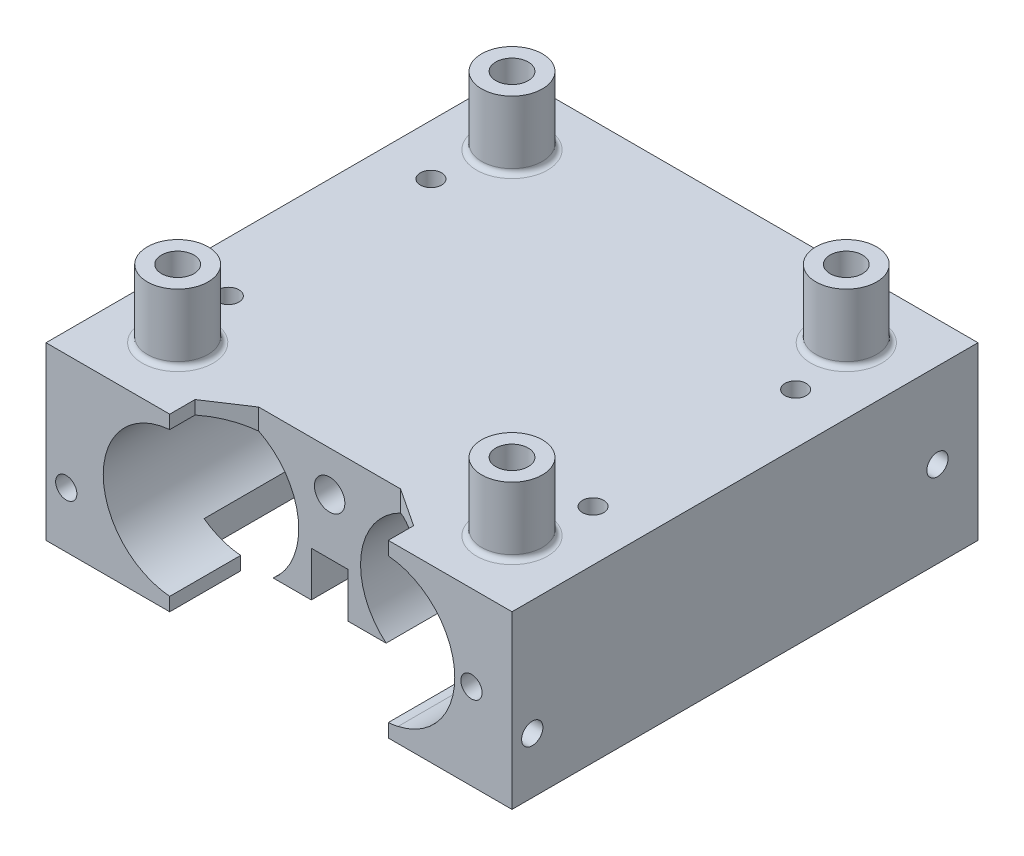
from build123d import *

# Parameters (mm, degrees)
CROQUIS4_W              = 46
CROQUIS4_H              = 46
SALIENTE_EXTRUIR1_DEPTH = 16.9
TALADRO1_D              = 2.1
TALADRO1_DEPTH          = 3
TALADRO1_TIP            = 0.63090365
TALADRO6_D              = 2.1
TALADRO6_DEPTH          = 3
TALADRO6_TIP            = 0.63090365
TALADRO7_D              = 2.1
TALADRO7_DEPTH          = 3
TALADRO7_TIP            = 0.63090365
TALADRO8_D              = 2.1
TALADRO8_DEPTH          = 3
TALADRO8_TIP            = 0.63090365
TALADRO10_D             = 2.1
TALADRO10_DEPTH         = 3
TALADRO10_TIP           = 0.63090365
TALADRO11_D             = 2.1
TALADRO11_DEPTH         = 3
TALADRO11_TIP           = 0.63090365
CROQUIS36_R             = 3
SALIENTE_EXTRUIR3_DEPTH = 6.7
TALADRO12_D             = 3.2
TALADRO12_DEPTH         = 7.6
TALADRO12_TIP           = 0.96137699
REDONDEO1_R             = 0.5
CROQUIS32_R             = 7.15
CORTAR_EXTRUIR1_DEPTH   = 46
CROQUIS42_W             = 23.493404382
CROQUIS42_H             = 32
CORTAR_EXTRUIR5_DEPTH   = 3
CORTAR_EXTRUIR3_DEPTH   = 37.655286113
CROQUIS43_W             = 2.65
CROQUIS43_H             = 3.393615988
CORTAR_EXTRUIR6_DEPTH   = 32
CORTAR_EXTRUIR7_DEPTH   = 4
CORTAR_EXTRUIR8_REACH   = 55.385
CROQUIS45_W             = 1.95106162
CROQUIS45_H             = 3
CORTAR_EXTRUIR9_DEPTH   = 31
CORTAR_EXTRUIR10_START  = -2
CORTAR_EXTRUIR10_DEPTH  = 2
CROQUIS49_W             = 3.787113981
CROQUIS49_H             = 2.270030689
CORTAR_EXTRUIR11_DEPTH  = 23
CROQUIS53_R             = 1.5
CORTAR_EXTRUIR13_DEPTH  = 53.601901106


with BuildPart() as part:
    # Croquis4 → Saliente-Extruir1 (new body)
    with BuildSketch(Plane(origin=(0, 0, 0), x_dir=(1, 0, 0), z_dir=(0, 1, 0))):
        Rectangle(CROQUIS4_W, CROQUIS4_H)
    extrude(amount=SALIENTE_EXTRUIR1_DEPTH)

    # Taladro1
    with Locations(Plane.XY.offset(23)):
        with Locations((-21, 5.5), (19, 8.5)):
            Hole(TALADRO1_D / 2, depth=TALADRO1_DEPTH)
            with Locations((0, 0, -(TALADRO1_DEPTH + TALADRO1_TIP / 2))):  # 118° drill point
                Cone(0, TALADRO1_D / 2, TALADRO1_TIP, mode=Mode.SUBTRACT)

    # Taladro6
    with Locations(Plane(origin=(23, 0, 0), x_dir=(0, 0, -1), z_dir=(1, 0, 0))):
        with Locations((-21, 5.5), (19, 8.5)):
            Hole(TALADRO6_D / 2, depth=TALADRO6_DEPTH)
            with Locations((0, 0, -(TALADRO6_DEPTH + TALADRO6_TIP / 2))):  # 118° drill point
                Cone(0, TALADRO6_D / 2, TALADRO6_TIP, mode=Mode.SUBTRACT)

    # Taladro7
    with Locations(Plane(origin=(0, 0, -23), x_dir=(-1, 0, 0), z_dir=(0, 0, -1))):
        with Locations((-21, 5.5), (19, 8.5)):
            Hole(TALADRO7_D / 2, depth=TALADRO7_DEPTH)
            with Locations((0, 0, -(TALADRO7_DEPTH + TALADRO7_TIP / 2))):  # 118° drill point
                Cone(0, TALADRO7_D / 2, TALADRO7_TIP, mode=Mode.SUBTRACT)

    # Taladro8
    with Locations(Plane.ZY.offset(23)):
        with Locations((-21, 5.5), (19, 8.5)):
            Hole(TALADRO8_D / 2, depth=TALADRO8_DEPTH)
            with Locations((0, 0, -(TALADRO8_DEPTH + TALADRO8_TIP / 2))):  # 118° drill point
                Cone(0, TALADRO8_D / 2, TALADRO8_TIP, mode=Mode.SUBTRACT)

    # Taladro10
    with Locations(Plane(origin=(-21, 0, 7), x_dir=(0, 0, -1), z_dir=(0, -1, 0))):
        with Locations((0, 0), (0, 42), (14, 42), (14, 0)):
            Hole(TALADRO10_D / 2, depth=TALADRO10_DEPTH)
            with Locations((0, 0, -(TALADRO10_DEPTH + TALADRO10_TIP / 2))):  # 118° drill point
                Cone(0, TALADRO10_D / 2, TALADRO10_TIP, mode=Mode.SUBTRACT)

    # Taladro11
    with Locations(Plane(origin=(-18, 16.9, -10), x_dir=(0, 0, 1), z_dir=(0, 1, 0))):
        with Locations((0, 0), (0, 36), (20, 36), (20, 0)):
            Hole(TALADRO11_D / 2, depth=TALADRO11_DEPTH)
            with Locations((0, 0, -(TALADRO11_DEPTH + TALADRO11_TIP / 2))):  # 118° drill point
                Cone(0, TALADRO11_D / 2, TALADRO11_TIP, mode=Mode.SUBTRACT)

    # Croquis36 → Saliente-Extruir3 (add)
    with BuildSketch(Plane(origin=(0, 16.9, 0), x_dir=(1, 0, 0), z_dir=(0, 1, 0))):
        with Locations(Location((-16.5, 16.5, 0), (0, 0, 90))):
            Circle(CROQUIS36_R)
        with Locations(Location((16.5, 16.5, 0), (0, 0, 90))):
            Circle(CROQUIS36_R)
        with Locations(Location((16.5, -16.5, 0), (0, 0, 90))):
            Circle(CROQUIS36_R)
        with Locations(Location((-16.5, -16.5, 0), (0, 0, 90))):
            Circle(CROQUIS36_R)
    extrude(amount=SALIENTE_EXTRUIR3_DEPTH)

    # Taladro12
    with Locations(Plane(origin=(-16.5, 23.6, 16.5), x_dir=(0, 0, 1), z_dir=(0, 1, 0))):
        with Locations((0, 0), (0, 33), (-33, 33), (-33, 0)):
            Hole(TALADRO12_D / 2, depth=TALADRO12_DEPTH)
            with Locations((0, 0, -(TALADRO12_DEPTH + TALADRO12_TIP / 2))):  # 118° drill point
                Cone(0, TALADRO12_D / 2, TALADRO12_TIP, mode=Mode.SUBTRACT)

    # Redondeo1
    redondeo1_edges = [part.edges().sort_by_distance(p)[0] for p in [
        (-16.5, 16.9, 19.5),
        (-16.5, 16.9, -13.5),
        (16.5, 16.9, -13.5),
        (16.5, 16.9, 19.5),
    ]]
    fillet(redondeo1_edges, radius=REDONDEO1_R)

    # Croquis32 → Cortar-Extruir1 (cut)
    with BuildSketch(Plane.XY.offset(23)):
        with Locations((-10.2, 8.45)):
            Circle(CROQUIS32_R)
        with Locations(Location((10.2, 8.45, 0), (0, 0, 180))):
            Circle(CROQUIS32_R)
    extrude(amount=-CORTAR_EXTRUIR1_DEPTH, mode=Mode.SUBTRACT)

    # Croquis42 → Cortar-Extruir5 (cut)
    with BuildSketch(Plane.XZ):
        Rectangle(CROQUIS42_W, CROQUIS42_H)
    extrude(amount=-CORTAR_EXTRUIR5_DEPTH, mode=Mode.SUBTRACT)

    # Croquis39 → Cortar-Extruir3 (cut, through all)
    with BuildSketch(Plane(origin=(0, 16.9, 0), x_dir=(1, 0, 0), z_dir=(0, 1, 0))):
        Polygon((-10.787113981, -20.5), (-10.787113981, -23), (10.787113981, -23), (10.787113981, -20.5), (7, -18), (-7, -18), align=None)
    extrude(amount=-CORTAR_EXTRUIR3_DEPTH, mode=Mode.SUBTRACT)

    # Croquis43 → Cortar-Extruir6 (cut)
    with BuildSketch(Plane.XY.offset(-16)):
        with Locations((-13.071702191, 1.696807994)):
            Rectangle(CROQUIS43_W, CROQUIS43_H)
    extrude(amount=CORTAR_EXTRUIR6_DEPTH, mode=Mode.SUBTRACT)

    # Croquis44 → Cortar-Extruir7 (cut)
    with BuildSketch(Plane(origin=(0, 0, -23), x_dir=(-1, 0, 0), z_dir=(0, 0, -1))):
        Polygon((-3.977126612, 9.408717688), (-3.977126612, 7.491282312), (-0.97553081, 7.491282312), (-0.97553081, 0), (0.97553081, 0), (0.97553081, 7.491282312), (3.977126612, 7.491282312), (3.977126612, 9.408717688), (4.878692477, 9.408717688), (4.878692477, 12.483889819), (2.725, 12.483889819), (-2.725, 12.483889819), (-4.878692477, 12.483889819), (-4.878692477, 9.408717688), align=None)
    extrude(amount=-CORTAR_EXTRUIR7_DEPTH, mode=Mode.SUBTRACT)

    # Croquis45 → Cortar-Extruir8 (cut, up to next)
    with BuildSketch(Plane(origin=(0, 0, -19), x_dir=(-1, 0, 0), z_dir=(0, 0, -1)), mode=Mode.PRIVATE) as cortar_extruir8_sk1:
        with Locations((0, 1.5)):
            Rectangle(CROQUIS45_W, CROQUIS45_H)
    cortar_extruir8_tool1 = extrude(cortar_extruir8_sk1.sketch, amount=-CORTAR_EXTRUIR8_REACH, mode=Mode.PRIVATE) & part.part
    add(cortar_extruir8_tool1.solids().sort_by_distance((0, 1.5, -19))[0], mode=Mode.SUBTRACT)

    # Croquis46 → Cortar-Extruir9 (cut)
    with BuildSketch(Plane.XY.offset(18)):
        Polygon((0, 0), (-1.814283194, 0), (-3.131306321, 0), (-1.814283194, 2.498681243), (-1.814283194, 7.427741726), (0, 7.427741726), (1.814283194, 7.427741726), (1.814283194, 2.498681243), (3.131306321, 0), (1.814283194, 0), align=None)
    extrude(amount=-CORTAR_EXTRUIR9_DEPTH, mode=Mode.SUBTRACT)

    # Croquis47 → Cortar-Extruir10 (cut)
    with BuildSketch(Plane.XY.offset(18).offset(CORTAR_EXTRUIR10_START)):
        Polygon((-7, 0), (-7, 3), (7.00622096, 3), (7, 0), align=None)
    extrude(amount=CORTAR_EXTRUIR10_DEPTH, mode=Mode.SUBTRACT)

    # Croquis49 → Cortar-Extruir11 (cut)
    with BuildSketch(Plane.XY):
        with Locations((8.893556991, 1.135015344)):
            Rectangle(CROQUIS49_W, CROQUIS49_H)
        with Locations((-8.893556991, 1.135015344)):
            Rectangle(CROQUIS49_W, CROQUIS49_H)
    extrude(amount=CORTAR_EXTRUIR11_DEPTH, mode=Mode.SUBTRACT)

    # Croquis53 → Cortar-Extruir13 (cut, through all)
    with BuildSketch(Plane.XY.offset(18)):
        with Locations((0, 12.915384615)):
            Circle(CROQUIS53_R)
    extrude(amount=-CORTAR_EXTRUIR13_DEPTH, mode=Mode.SUBTRACT)


solid = part.part
